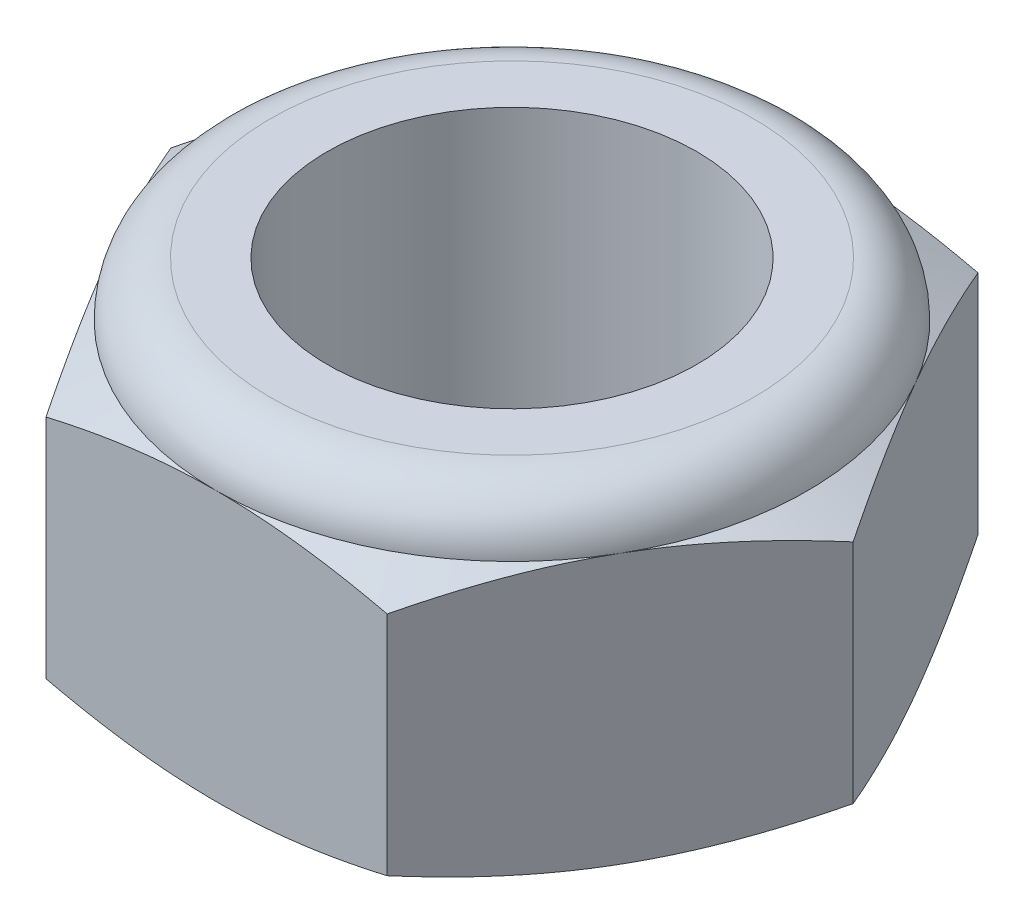
from build123d import *

# Parameters (mm, degrees)
BASE_EXTRUDE_DEPTH = 55.5752
SKETCH2_R          = 31.75
CUT_EXTRUDE1_DEPTH = 96.446823878


with BuildPart() as part:
    # Sketch1 → Base-Extrude (new body)
    with BuildSketch(Plane(origin=(0, 0, 0), x_dir=(1, 0, 0), z_dir=(0, 1, 0))):
        Polygon((58.65878735, 0), (29.329393675, 50.8), (-29.329393675, 50.8), (-58.65878735, 0), (-29.329393675, -50.8), (29.329393675, -50.8), align=None)
    extrude(amount=BASE_EXTRUDE_DEPTH)

    # Sketch2 → Cut-Extrude1 (cut, through all)
    with BuildSketch(Plane(origin=(0, 0, 0), x_dir=(-1, 0, 0), z_dir=(0, -1, 0))):
        Circle(SKETCH2_R)
    extrude(amount=-CUT_EXTRUDE1_DEPTH, mode=Mode.SUBTRACT)

    # Sketch10 → Cut-Revolve3 (revolve, cut)
    with BuildSketch(Plane.XY):
        with BuildLine():
            Line((0, 56.8452), (59.9186, 56.8452))
            Line((59.9186, 56.8452), (59.9186, -1.27))
            Line((59.9186, -1.27), (0, -1.27))
            Line((0, -1.27), (0, 0))
            Line((0, 0), (50.81018735, 0))
            Line((50.81018735, 0), (58.65878735, 3.659862286))
            Line((58.65878735, 3.659862286), (58.65878735, 42.639587275))
            Line((58.65878735, 42.639587275), (50.8, 46.3042))
            ThreePointArc((50.8, 46.3042), (48.084586968, 52.859786968), (41.529, 55.5752))
            Line((41.529, 55.5752), (0, 55.5752))
            Line((0, 55.5752), (0, 56.8452))
        make_face()
    revolve(axis=Axis((0, 55.5752, 0), (0, -1, 0)), mode=Mode.SUBTRACT)


solid = part.part
